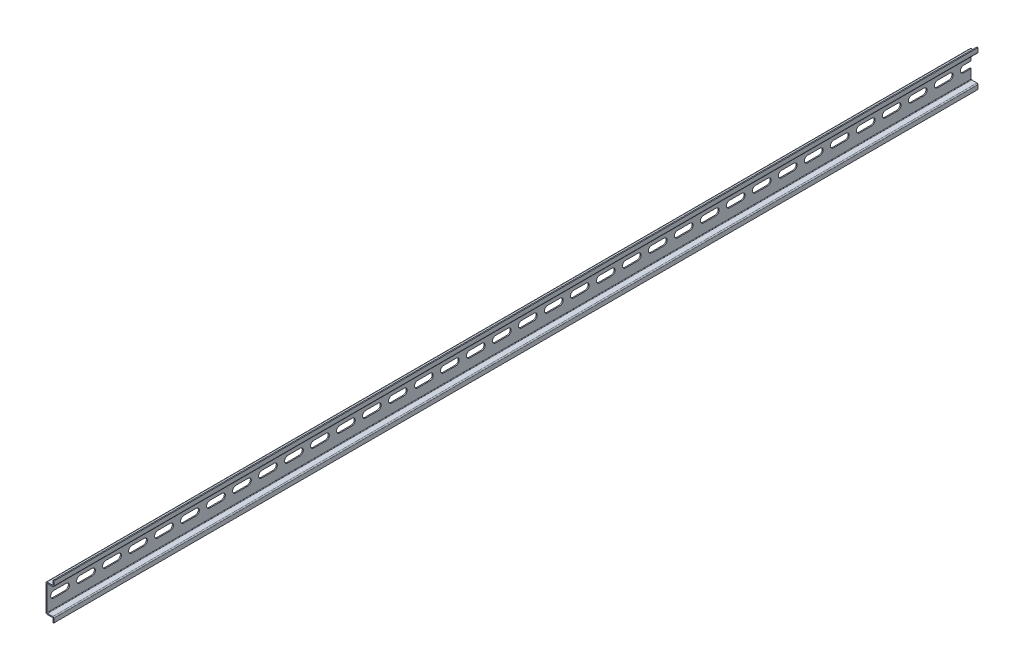
from build123d import *

# Parameters (mm, degrees)
BOSS_EXTRUDE1_DEPTH = 444.5
CUT_EXTRUDE1_DEPTH  = 7.5
LPATTERN1_COUNT     = 36
LPATTERN1_PITCH     = 25


with BuildPart() as part:
    # Sketch1 → Boss-Extrude1 (new, symmetric)
    with BuildSketch(Plane.XY):
        with BuildLine():
            Line((7.5, 17.5), (6.5, 17.5))
            Line((6.5, 17.5), (6.5, 14))
            ThreePointArc((6.5, 14), (6.353553391, 13.646446609), (6, 13.5))
            Line((6, 13.5), (1, 13.5))
            ThreePointArc((1, 13.5), (0.292893219, 13.207106781), (0, 12.5))
            Line((0, 12.5), (0, -12.5))
            ThreePointArc((0, -12.5), (0.292893219, -13.207106781), (1, -13.5))
            Line((1, -13.5), (6, -13.5))
            ThreePointArc((6, -13.5), (6.353553391, -13.646446609), (6.5, -14))
            Line((6.5, -14), (6.5, -17.5))
            Line((6.5, -17.5), (7.5, -17.5))
            Line((7.5, -17.5), (7.5, -13.5))
            ThreePointArc((7.5, -13.5), (7.207106781, -12.792893219), (6.5, -12.5))
            Line((6.5, -12.5), (1.5, -12.5))
            ThreePointArc((1.5, -12.5), (1.146446609, -12.353553391), (1, -12))
            Line((1, -12), (1, 12))
            ThreePointArc((1, 12), (1.146446609, 12.353553391), (1.5, 12.5))
            Line((1.5, 12.5), (6.5, 12.5))
            ThreePointArc((6.5, 12.5), (7.207106781, 12.792893219), (7.5, 13.5))
            Line((7.5, 13.5), (7.5, 17.5))
        make_face()
    extrude(amount=BOSS_EXTRUDE1_DEPTH, both=True)

    # Sketch2 → Cut-Extrude1 (cut)
    with BuildSketch(Plane(origin=(0, 0, 0), x_dir=(0, 0, -1), z_dir=(1, 0, 0))):
        with BuildLine():
            Line((-437.85, 3.15), (-426.15, 3.15))
            ThreePointArc((-426.15, 3.15), (-423, 0), (-426.15, -3.15))
            Line((-426.15, -3.15), (-437.85, -3.15))
            ThreePointArc((-437.85, -3.15), (-441, 0), (-437.85, 3.15))
        make_face()
    cut_extrude1 = extrude(amount=CUT_EXTRUDE1_DEPTH, mode=Mode.SUBTRACT)

    # LPattern1: Cut-Extrude1 ×36
    with Locations(*[(0, 0, -i * LPATTERN1_PITCH) for i in range(1, LPATTERN1_COUNT)]):
        add(cut_extrude1, mode=Mode.SUBTRACT)


solid = part.part
